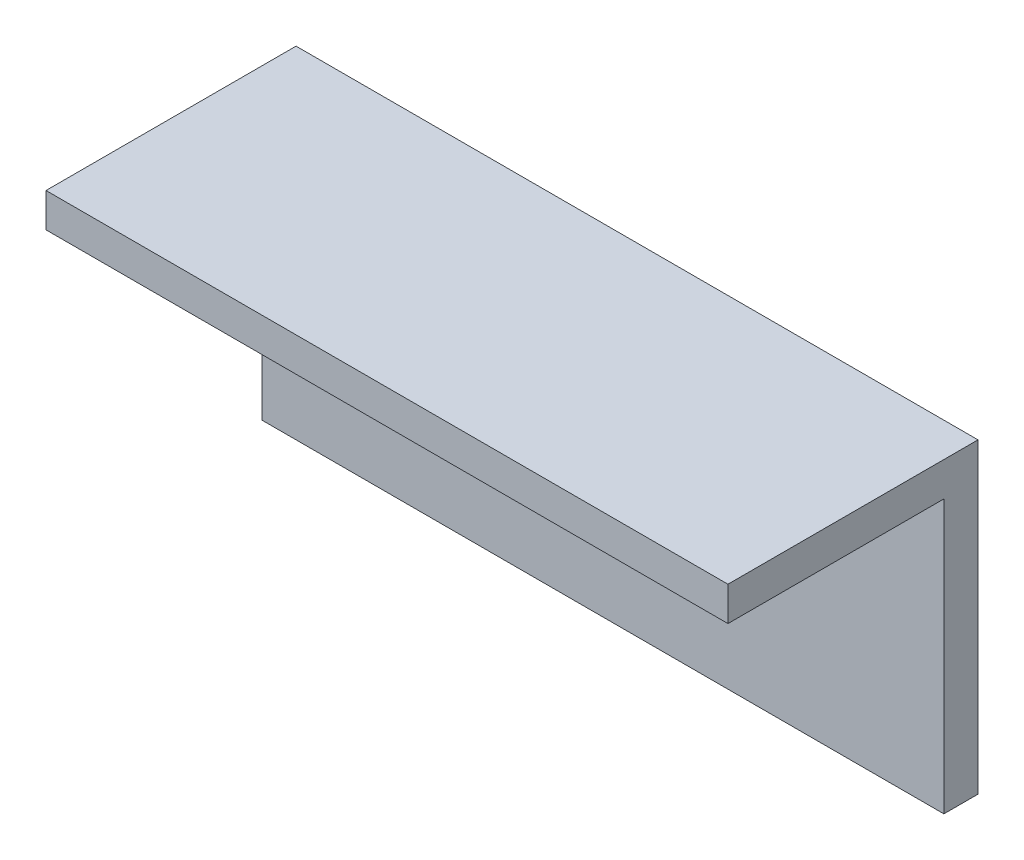
from build123d import *

# Parameters (mm, degrees)
SKETCH_1_W      = 60
SKETCH_1_H      = 27
EXTRUDE_1_DEPTH = 3
SKETCH_2_W      = 60
SKETCH_2_H      = 3
EXTRUDE_2_DEPTH = 19


with BuildPart() as part:
    # 스케치1 → 보스-돌출1 (new body)
    with BuildSketch(Plane.XY):
        Rectangle(SKETCH_1_W, SKETCH_1_H)
    extrude(amount=EXTRUDE_1_DEPTH)

    # 스케치2 → 보스-돌출2 (add)
    with BuildSketch(Plane.XY.offset(3)):
        with Locations((0, 12)):
            Rectangle(SKETCH_2_W, SKETCH_2_H)
    extrude(amount=EXTRUDE_2_DEPTH)


solid = part.part
